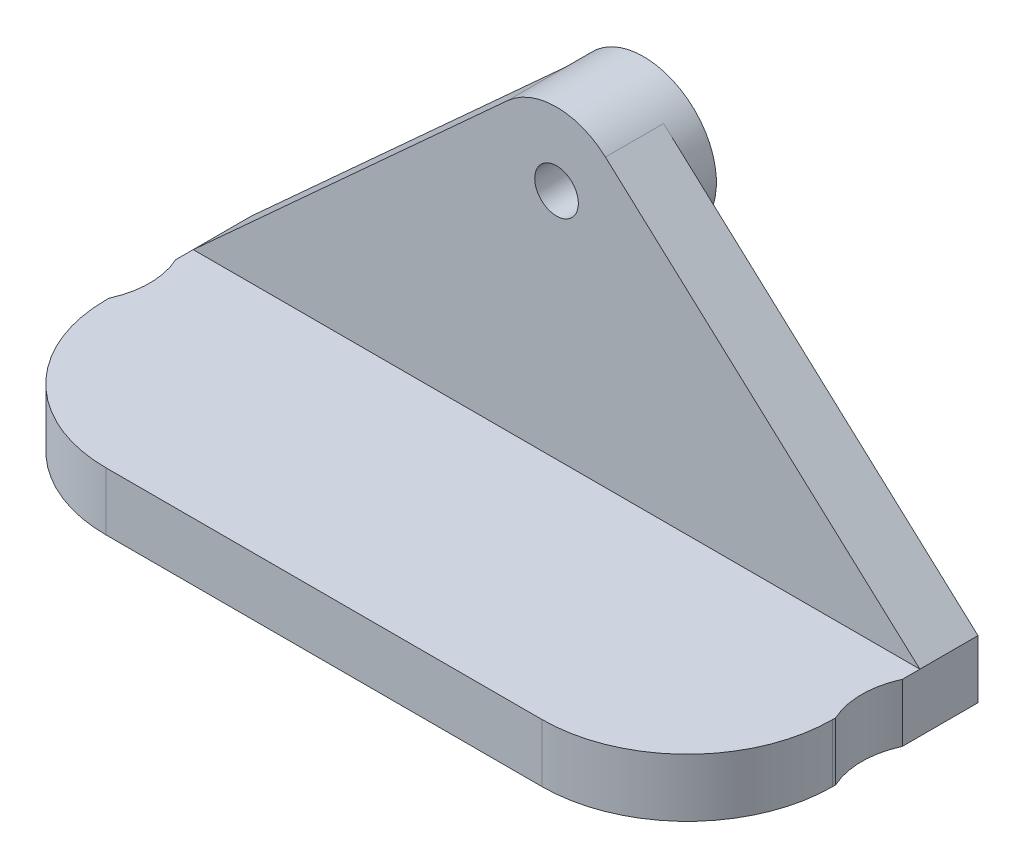
from build123d import *

# Parameters (mm, degrees)
CROQUIS1_W              = 50
CROQUIS1_H              = 20
SALIENTE_EXTRUIR1_DEPTH = 4
CROQUIS2_R              = 1.5
SALIENTE_EXTRUIR4_DEPTH = 4
SALIENTE_EXTRUIR5_START = 2
CROQUIS2_3_R            = 1.5
SALIENTE_EXTRUIR5_DEPTH = 2
CORTAR_EXTRUIR1_REACH   = 36.785
CROQUIS5_R              = 5.5
REDONDEO1_R             = 10


with BuildPart() as part:
    # Croquis1 → Saliente-Extruir1 (new body)
    with BuildSketch(Plane(origin=(0, 0, 0), x_dir=(1, 0, 0), z_dir=(0, 1, 0))):
        Rectangle(CROQUIS1_W, CROQUIS1_H)
    extrude(amount=SALIENTE_EXTRUIR1_DEPTH)

    # Croquis2 → Saliente-Extruir4 (add)
    with BuildSketch(Plane(origin=(0, 0, -10), x_dir=(-1, 0, 0), z_dir=(0, 0, -1))):
        with BuildLine():
            Line((-3.366172774, 23.69714496), (-25, 4))
            Line((-25, 4), (25, 4))
            Line((25, 4), (3.366172774, 23.69714496))
            ThreePointArc((3.366172774, 23.69714496), (0, 25), (-3.366172774, 23.69714496))
        make_face()
        with Locations((0, 20)):
            Circle(CROQUIS2_R, mode=Mode.SUBTRACT)
    extrude(amount=-SALIENTE_EXTRUIR4_DEPTH)

    # Croquis2<3> → Saliente-Extruir5 (add)
    with BuildSketch(Plane(origin=(0, 0, -10), x_dir=(-1, 0, 0), z_dir=(0, 0, -1)).offset(SALIENTE_EXTRUIR5_START)):
        with BuildLine():
            ThreePointArc((3.366172774, 23.69714496), (0, 25), (-3.366172774, 23.69714496))
            ThreePointArc((-3.366172774, 23.69714496), (-2.021031436, 15.426660746), (5, 20))
            ThreePointArc((5, 20), (4.573339254, 22.021031436), (3.366172774, 23.69714496))
        make_face()
        with Locations((0, 20)):
            Circle(CROQUIS2_3_R, mode=Mode.SUBTRACT)
    extrude(amount=-SALIENTE_EXTRUIR5_DEPTH)

    # Croquis5 → Cortar-Extruir1 (cut, up to next)
    with BuildSketch(Plane(origin=(0, 4, 0), x_dir=(1, 0, 0), z_dir=(0, 1, 0)), mode=Mode.PRIVATE) as cortar_extruir1_sk1:
        with Locations((-30, 2.5)):
            Circle(CROQUIS5_R)
    cortar_extruir1_tool1 = extrude(cortar_extruir1_sk1.sketch, amount=-CORTAR_EXTRUIR1_REACH, mode=Mode.PRIVATE) & part.part
    # Croquis5 → Cortar-Extruir1 (cut, up to next)
    with BuildSketch(Plane(origin=(0, 4, 0), x_dir=(1, 0, 0), z_dir=(0, 1, 0)), mode=Mode.PRIVATE) as cortar_extruir1_sk2:
        with Locations((30, 2.5)):
            Circle(CROQUIS5_R)
    cortar_extruir1_tool2 = extrude(cortar_extruir1_sk2.sketch, amount=-CORTAR_EXTRUIR1_REACH, mode=Mode.PRIVATE) & part.part
    add(cortar_extruir1_tool1.solids().sort_by_distance((-30, 4, -2.5))[0], mode=Mode.SUBTRACT)
    add(cortar_extruir1_tool2.solids().sort_by_distance((30, 4, -2.5))[0], mode=Mode.SUBTRACT)

    # Redondeo1
    redondeo1_edges = [part.edges().sort_by_distance(p)[0] for p in [
        (25, 2, 10),
        (-25, 2, 10),
    ]]
    fillet(redondeo1_edges, radius=REDONDEO1_R)


solid = part.part
